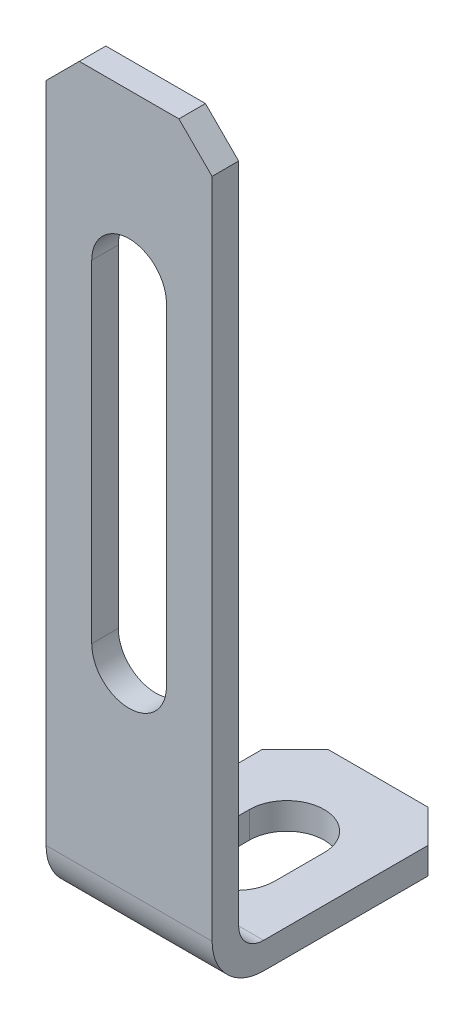
from build123d import *

# Parameters (mm, degrees)
SKETCH1_W           = 15
SKETCH1_H           = 45
BOSS_EXTRUDE1_DEPTH = 10
SKETCH2_W           = 13.4
SKETCH2_H           = 43.4
CUT_EXTRUDE1_DEPTH  = 49.476798574
CUT_EXTRUDE2_DEPTH  = 47.995318916
CUT_EXTRUDE3_DEPTH  = 49.476798574
CHAMFER1_SIZE       = 2
FILLET1_R           = 1.5
FILLET2_R           = 3.1


with BuildPart() as part:
    # Sketch1 → Boss-Extrude1 (new body)
    with BuildSketch(Plane(origin=(10, 0, 0), x_dir=(0, 0, -1), z_dir=(1, 0, 0))):
        with Locations((7.5, 22.5)):
            Rectangle(SKETCH1_W, SKETCH1_H)
    extrude(amount=-BOSS_EXTRUDE1_DEPTH)

    # Sketch2 → Cut-Extrude1 (cut, through all)
    with BuildSketch(Plane.ZY):
        with Locations((-8.3, 23.3)):
            Rectangle(SKETCH2_W, SKETCH2_H)
    extrude(amount=-CUT_EXTRUDE1_DEPTH, mode=Mode.SUBTRACT)

    # Sketch3 → Cut-Extrude2 (cut, through all)
    with BuildSketch(Plane(origin=(0, 1.6, 0), x_dir=(-1, 0, 0), z_dir=(0, 1, 0))):
        with BuildLine():
            Line((-2.75, -9.5), (-2.75, -6.5))
            ThreePointArc((-2.75, -6.5), (-5, -4.25), (-7.25, -6.5))
            Line((-7.25, -6.5), (-7.25, -9.5))
            ThreePointArc((-7.25, -9.5), (-5, -11.75), (-2.75, -9.5))
        make_face()
    extrude(amount=-CUT_EXTRUDE2_DEPTH, mode=Mode.SUBTRACT)

    # Sketch4 → Cut-Extrude3 (cut, through all)
    with BuildSketch(Plane.XY):
        with BuildLine():
            Line((7.25, 15), (7.25, 35))
            ThreePointArc((7.25, 35), (5, 37.25), (2.75, 35))
            Line((2.75, 35), (2.75, 15))
            ThreePointArc((2.75, 15), (5, 12.75), (7.25, 15))
        make_face()
    extrude(amount=-CUT_EXTRUDE3_DEPTH, mode=Mode.SUBTRACT)

    # Chamfer1
    chamfer1_edges = [part.edges().sort_by_distance(p)[0] for p in [
        (0, 0.8, -15),
        (10, 45, -0.8),
        (0, 45, -0.8),
        (10, 0.8, -15),
    ]]
    chamfer(chamfer1_edges, length=CHAMFER1_SIZE)

    # Fillet1
    fillet1_edges = [part.edges().sort_by_distance(p)[0] for p in [
        (5, 1.6, -1.6),
    ]]
    fillet(fillet1_edges, radius=FILLET1_R)

    # Fillet2
    fillet2_edges = [part.edges().sort_by_distance(p)[0] for p in [
        (5, 0, 0),
    ]]
    fillet(fillet2_edges, radius=FILLET2_R)


solid = part.part
